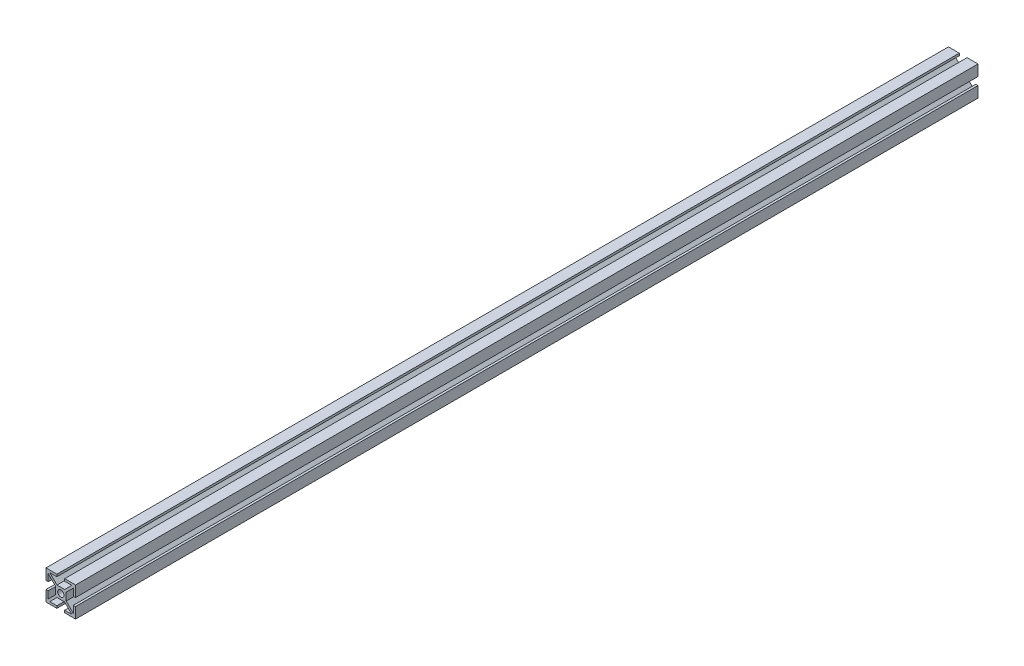
from build123d import *

# Parameters (mm, degrees)
SKETCH1_R           = 2.095
BOSS_EXTRUDE1_DEPTH = 610


with BuildPart() as part:
    # Sketch1 → Boss-Extrude1 (new body)
    with BuildSketch(Plane.XY):
        Polygon((6.345, 12.594339828), (1.5, 17.439339828), (1.5, 12.63), (0, 12.63), (0, 20), (7.37, 20), (7.37, 18.5), (2.560660172, 18.5), (7.405660172, 13.655), (12.594339828, 13.655), (17.439339828, 18.5), (12.63, 18.5), (12.63, 20), (20, 20), (20, 12.63), (18.5, 12.63), (18.5, 17.439339828), (13.655, 12.594339828), (13.655, 7.405660172), (18.5, 2.560660172), (18.5, 7.37), (20, 7.37), (20, 0), (12.63, 0), (12.63, 1.5), (17.439339828, 1.5), (12.594339828, 6.345), (7.405660172, 6.345), (2.560660172, 1.5), (7.37, 1.5), (7.37, 0), (0, 0), (0, 7.37), (1.5, 7.37), (1.5, 2.560660172), (6.345, 7.405660172), align=None)
        with Locations((10, 10)):
            Circle(SKETCH1_R, mode=Mode.SUBTRACT)
    extrude(amount=BOSS_EXTRUDE1_DEPTH)


solid = part.part
